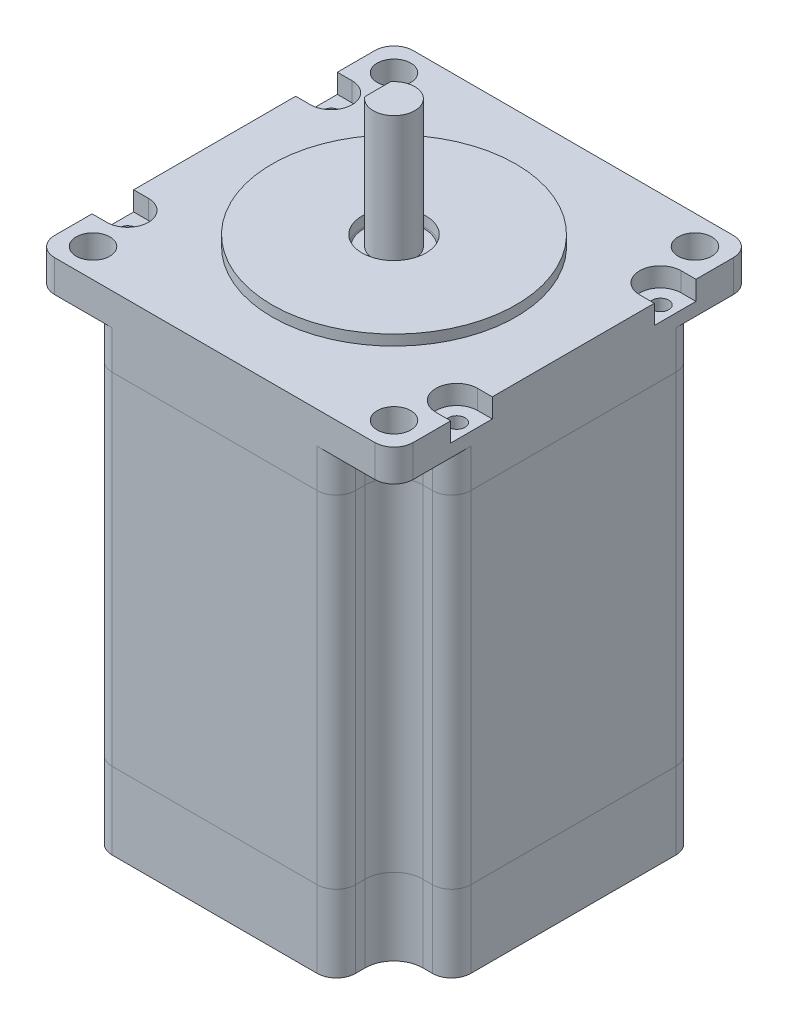
from build123d import *

# Parameters (mm, degrees)
SKETCH2_R           = 1.3
SKETCH2_R_2         = 5
BOSS_EXTRUDE2_DEPTH = 12
BOSS_EXTRUDE3_START = 12
SKETCH2_5_R         = 1.3
SKETCH2_5_R_2       = 5
BOSS_EXTRUDE3_DEPTH = 53.3
BOSS_EXTRUDE4_START = 65.3
SKETCH2_6_R         = 1.3
SKETCH2_6_R_2       = 5
BOSS_EXTRUDE4_DEPTH = 6
SKETCH4_W           = 56
SKETCH4_H           = 56
SKETCH4_R           = 2.625
SKETCH4_R_2         = 5
SKETCH4_R_3         = 1.3
BOSS_EXTRUDE5_DEPTH = 5
CUT_EXTRUDE1_START  = 2
CUT_EXTRUDE1_DEPTH  = 3
BOSS_EXTRUDE6_DEPTH = 20
SKETCH7_R           = 4.75
BOSS_EXTRUDE7_DEPTH = 74
SKETCH8_R           = 19.05
SKETCH8_R_2         = 5
BOSS_EXTRUDE8_DEPTH = 1.63
FILLET1_R           = 3


with BuildPart() as part:
    # Sketch2 → Boss-Extrude2 (new body)
    with BuildSketch(Plane(origin=(0, 0, 0), x_dir=(1, 0, 0), z_dir=(0, 1, 0))):
        with BuildLine():
            Line((-16, 28), (16, 28))
            ThreePointArc((16, 28), (18.121320344, 27.121320344), (19, 25))
            Line((19, 25), (19, 23.499265338))
            ThreePointArc((19, 23.499265338), (20.317804307, 20.317804307), (23.499265338, 19))
            Line((23.499265338, 19), (25, 19))
            ThreePointArc((25, 19), (27.121320344, 18.121320344), (28, 16))
            Line((28, 16), (28, -16))
            ThreePointArc((28, -16), (27.121320344, -18.121320344), (25, -19))
            Line((25, -19), (23.499265338, -19))
            ThreePointArc((23.499265338, -19), (20.317804307, -20.317804307), (19, -23.499265338))
            Line((19, -23.499265338), (19, -25))
            ThreePointArc((19, -25), (18.121320344, -27.121320344), (16, -28))
            Line((16, -28), (-16, -28))
            ThreePointArc((-16, -28), (-18.121320344, -27.121320344), (-19, -25))
            Line((-19, -25), (-19, -23.499265338))
            ThreePointArc((-19, -23.499265338), (-20.317804307, -20.317804307), (-23.499265338, -19))
            Line((-23.499265338, -19), (-25, -19))
            ThreePointArc((-25, -19), (-27.121320344, -18.121320344), (-28, -16))
            Line((-28, -16), (-28, 16))
            ThreePointArc((-28, 16), (-27.121320344, 18.121320344), (-25, 19))
            Line((-25, 19), (-23.499265338, 19))
            ThreePointArc((-23.499265338, 19), (-20.317804307, 20.317804307), (-19, 23.499265338))
            Line((-19, 23.499265338), (-19, 25))
            ThreePointArc((-19, 25), (-18.121320344, 27.121320344), (-16, 28))
        make_face()
        with Locations(Location((-25.7, 15.9, 0), (0, 0, 270))):
            Circle(SKETCH2_R, mode=Mode.SUBTRACT)
        with Locations(Location((25.7, 15.9, 0), (0, 0, 270))):
            Circle(SKETCH2_R, mode=Mode.SUBTRACT)
        with Locations(Location((-25.7, -15.9, 0), (0, 0, 270))):
            Circle(SKETCH2_R, mode=Mode.SUBTRACT)
        with Locations(Location((25.7, -15.9, 0), (0, 0, 270))):
            Circle(SKETCH2_R, mode=Mode.SUBTRACT)
        with Locations(Location((0, 0, 0), (0, 0, 270))):
            Circle(SKETCH2_R_2, mode=Mode.SUBTRACT)
    extrude(amount=BOSS_EXTRUDE2_DEPTH)


with BuildPart() as body_2:
    # Sketch2<5> → Boss-Extrude3 (new body)
    with BuildSketch(Plane(origin=(0, 0, 0), x_dir=(1, 0, 0), z_dir=(0, 1, 0)).offset(BOSS_EXTRUDE3_START)):
        with BuildLine():
            Line((-16, 28), (16, 28))
            ThreePointArc((16, 28), (18.121320344, 27.121320344), (19, 25))
            Line((19, 25), (19, 23.499265338))
            ThreePointArc((19, 23.499265338), (20.317804307, 20.317804307), (23.499265338, 19))
            Line((23.499265338, 19), (25, 19))
            ThreePointArc((25, 19), (27.121320344, 18.121320344), (28, 16))
            Line((28, 16), (28, -16))
            ThreePointArc((28, -16), (27.121320344, -18.121320344), (25, -19))
            Line((25, -19), (23.499265338, -19))
            ThreePointArc((23.499265338, -19), (20.317804307, -20.317804307), (19, -23.499265338))
            Line((19, -23.499265338), (19, -25))
            ThreePointArc((19, -25), (18.121320344, -27.121320344), (16, -28))
            Line((16, -28), (-16, -28))
            ThreePointArc((-16, -28), (-18.121320344, -27.121320344), (-19, -25))
            Line((-19, -25), (-19, -23.499265338))
            ThreePointArc((-19, -23.499265338), (-20.317804307, -20.317804307), (-23.499265338, -19))
            Line((-23.499265338, -19), (-25, -19))
            ThreePointArc((-25, -19), (-27.121320344, -18.121320344), (-28, -16))
            Line((-28, -16), (-28, 16))
            ThreePointArc((-28, 16), (-27.121320344, 18.121320344), (-25, 19))
            Line((-25, 19), (-23.499265338, 19))
            ThreePointArc((-23.499265338, 19), (-20.317804307, 20.317804307), (-19, 23.499265338))
            Line((-19, 23.499265338), (-19, 25))
            ThreePointArc((-19, 25), (-18.121320344, 27.121320344), (-16, 28))
        make_face()
        with Locations(Location((-25.7, 15.9, 0), (0, 0, 270))):
            Circle(SKETCH2_5_R, mode=Mode.SUBTRACT)
        with Locations(Location((25.7, 15.9, 0), (0, 0, 270))):
            Circle(SKETCH2_5_R, mode=Mode.SUBTRACT)
        with Locations(Location((-25.7, -15.9, 0), (0, 0, 270))):
            Circle(SKETCH2_5_R, mode=Mode.SUBTRACT)
        with Locations(Location((25.7, -15.9, 0), (0, 0, 270))):
            Circle(SKETCH2_5_R, mode=Mode.SUBTRACT)
        with Locations(Location((0, 0, 0), (0, 0, 270))):
            Circle(SKETCH2_5_R_2, mode=Mode.SUBTRACT)
    extrude(amount=BOSS_EXTRUDE3_DEPTH)


with BuildPart() as body_3:
    # Sketch2<6> → Boss-Extrude4 (new body)
    with BuildSketch(Plane(origin=(0, 0, 0), x_dir=(1, 0, 0), z_dir=(0, 1, 0)).offset(BOSS_EXTRUDE4_START)):
        with BuildLine():
            Line((-16, 28), (16, 28))
            ThreePointArc((16, 28), (18.121320344, 27.121320344), (19, 25))
            Line((19, 25), (19, 23.499265338))
            ThreePointArc((19, 23.499265338), (20.317804307, 20.317804307), (23.499265338, 19))
            Line((23.499265338, 19), (25, 19))
            ThreePointArc((25, 19), (27.121320344, 18.121320344), (28, 16))
            Line((28, 16), (28, -16))
            ThreePointArc((28, -16), (27.121320344, -18.121320344), (25, -19))
            Line((25, -19), (23.499265338, -19))
            ThreePointArc((23.499265338, -19), (20.317804307, -20.317804307), (19, -23.499265338))
            Line((19, -23.499265338), (19, -25))
            ThreePointArc((19, -25), (18.121320344, -27.121320344), (16, -28))
            Line((16, -28), (-16, -28))
            ThreePointArc((-16, -28), (-18.121320344, -27.121320344), (-19, -25))
            Line((-19, -25), (-19, -23.499265338))
            ThreePointArc((-19, -23.499265338), (-20.317804307, -20.317804307), (-23.499265338, -19))
            Line((-23.499265338, -19), (-25, -19))
            ThreePointArc((-25, -19), (-27.121320344, -18.121320344), (-28, -16))
            Line((-28, -16), (-28, 16))
            ThreePointArc((-28, 16), (-27.121320344, 18.121320344), (-25, 19))
            Line((-25, 19), (-23.499265338, 19))
            ThreePointArc((-23.499265338, 19), (-20.317804307, 20.317804307), (-19, 23.499265338))
            Line((-19, 23.499265338), (-19, 25))
            ThreePointArc((-19, 25), (-18.121320344, 27.121320344), (-16, 28))
        make_face()
        with Locations(Location((-25.7, 15.9, 0), (0, 0, 270))):
            Circle(SKETCH2_6_R, mode=Mode.SUBTRACT)
        with Locations(Location((25.7, 15.9, 0), (0, 0, 270))):
            Circle(SKETCH2_6_R, mode=Mode.SUBTRACT)
        with Locations(Location((-25.7, -15.9, 0), (0, 0, 270))):
            Circle(SKETCH2_6_R, mode=Mode.SUBTRACT)
        with Locations(Location((25.7, -15.9, 0), (0, 0, 270))):
            Circle(SKETCH2_6_R, mode=Mode.SUBTRACT)
        with Locations(Location((0, 0, 0), (0, 0, 270))):
            Circle(SKETCH2_6_R_2, mode=Mode.SUBTRACT)
    extrude(amount=BOSS_EXTRUDE4_DEPTH)

    # Sketch4 → Boss-Extrude5 (add)
    with BuildSketch(Plane(origin=(0, 71.3, 0), x_dir=(1, 0, 0), z_dir=(0, 1, 0))):
        Rectangle(SKETCH4_W, SKETCH4_H)
        with Locations(Location((-23.499265338, -23.499265338, 0), (0, 0, 270))):
            Circle(SKETCH4_R, mode=Mode.SUBTRACT)
        with Locations(Location((23.499265338, -23.499265338, 0), (0, 0, 270))):
            Circle(SKETCH4_R, mode=Mode.SUBTRACT)
        with Locations(Location((-23.499265338, 23.499265338, 0), (0, 0, 270))):
            Circle(SKETCH4_R, mode=Mode.SUBTRACT)
        with Locations(Location((0, 0, 0), (0, 0, 270))):
            Circle(SKETCH4_R_2, mode=Mode.SUBTRACT)
        with Locations(Location((23.499265338, 23.499265338, 0), (0, 0, 270))):
            Circle(SKETCH4_R, mode=Mode.SUBTRACT)
        with Locations(Location((-25.7, 15.9, 0), (0, 0, 270))):
            Circle(SKETCH4_R_3, mode=Mode.SUBTRACT)
        with Locations(Location((25.7, 15.9, 0), (0, 0, 270))):
            Circle(SKETCH4_R_3, mode=Mode.SUBTRACT)
        with Locations(Location((-25.7, -15.9, 0), (0, 0, 270))):
            Circle(SKETCH4_R_3, mode=Mode.SUBTRACT)
        with Locations(Location((25.7, -15.9, 0), (0, 0, 270))):
            Circle(SKETCH4_R_3, mode=Mode.SUBTRACT)
    extrude(amount=BOSS_EXTRUDE5_DEPTH)

    # Sketch5 → Cut-Extrude1 (cut)
    with BuildSketch(Plane(origin=(0, 71.3, 0), x_dir=(1, 0, 0), z_dir=(0, 1, 0)).offset(CUT_EXTRUDE1_START)):
        with BuildLine():
            Line((-28, 19.15), (-28, 12.65))
            Line((-28, 12.65), (-25.7, 12.65))
            ThreePointArc((-25.7, 12.65), (-22.45, 15.9), (-25.7, 19.15))
            Line((-25.7, 19.15), (-28, 19.15))
        make_face()
        with BuildLine():
            Line((25.7, 19.15), (28, 19.15))
            Line((28, 19.15), (28, 12.65))
            Line((28, 12.65), (25.7, 12.65))
            ThreePointArc((25.7, 12.65), (22.45, 15.9), (25.7, 19.15))
        make_face()
        with BuildLine():
            Line((28, -19.15), (28, -12.65))
            Line((28, -12.65), (25.7, -12.65))
            ThreePointArc((25.7, -12.65), (22.45, -15.9), (25.7, -19.15))
            Line((25.7, -19.15), (28, -19.15))
        make_face()
        with BuildLine():
            Line((-25.7, -19.15), (-28, -19.15))
            Line((-28, -19.15), (-28, -12.65))
            Line((-28, -12.65), (-25.7, -12.65))
            ThreePointArc((-25.7, -12.65), (-22.45, -15.9), (-25.7, -19.15))
        make_face()
    extrude(amount=CUT_EXTRUDE1_DEPTH, mode=Mode.SUBTRACT)

    # Fillet1
    fillet1_edges = [body_3.edges().sort_by_distance(p)[0] for p in [
        (-28, 73.8, -28),
        (-28, 73.8, 28),
        (28, 73.8, 28),
        (28, 73.8, -28),
    ]]
    fillet(fillet1_edges, radius=FILLET1_R)


with BuildPart() as body_4:
    # Sketch6 → Boss-Extrude6 (new body)
    with BuildSketch(Plane(origin=(0, 76.3, 0), x_dir=(1, 0, 0), z_dir=(0, 1, 0))):
        with BuildLine():
            Line((-2.55, -2.014944168), (-2.55, 2.014944168))
            ThreePointArc((-2.55, 2.014944168), (3.25, 0), (-2.55, -2.014944168))
        make_face()
    extrude(amount=BOSS_EXTRUDE6_DEPTH)


with BuildPart() as body_5:
    # Sketch7 → Boss-Extrude7 (new body)
    with BuildSketch(Plane(origin=(0, 76.3, 0), x_dir=(1, 0, 0), z_dir=(0, 1, 0))):
        with Locations(Location((0, 0, 0), (0, 0, 270))):
            Circle(SKETCH7_R)
    extrude(amount=-BOSS_EXTRUDE7_DEPTH)


with BuildPart() as body_6:
    # Sketch8 → Boss-Extrude8 (new body)
    with BuildSketch(Plane(origin=(0, 76.3, 0), x_dir=(1, 0, 0), z_dir=(0, 1, 0))):
        with Locations(Location((0, 0, 0), (0, 0, 270))):
            Circle(SKETCH8_R)
        with Locations(Location((0, 0, 0), (0, 0, 270))):
            Circle(SKETCH8_R_2, mode=Mode.SUBTRACT)
    extrude(amount=BOSS_EXTRUDE8_DEPTH)


solid = Compound([part.part, body_2.part, body_3.part, body_4.part, body_5.part, body_6.part])
